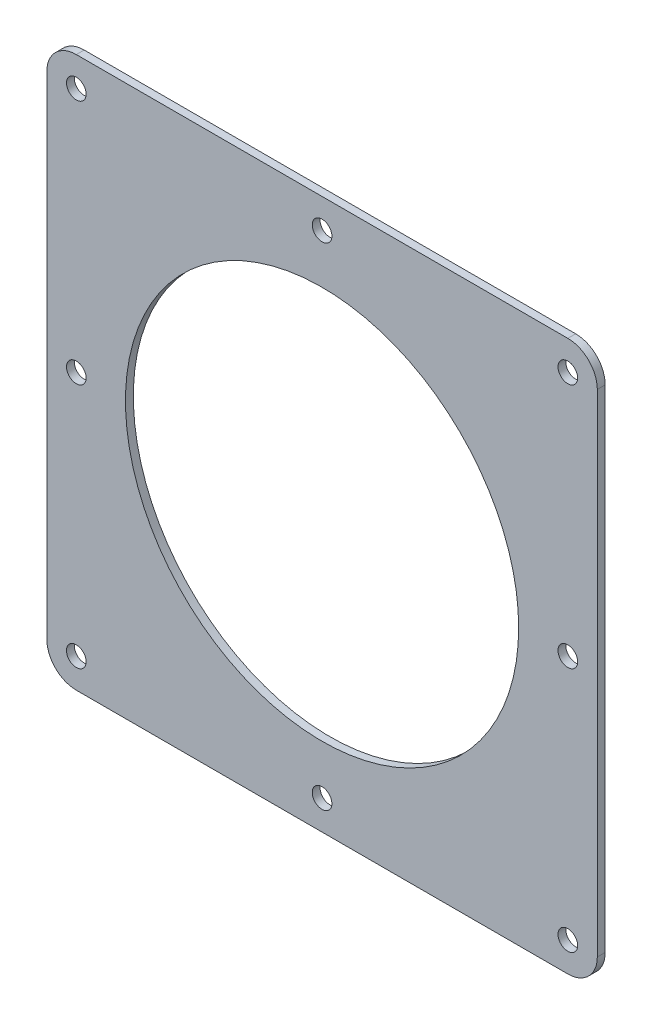
from build123d import *

# Parameters (mm, degrees)
SKETCH2_R           = 5
SKETCH2_R_2         = 4
BOSS_EXTRUDE1_DEPTH = 4
SKETCH7_R           = 100
CUT_EXTRUDE2_DEPTH  = 10


with BuildPart() as part:
    # Sketch2 → Boss-Extrude1 (new body)
    with BuildSketch(Plane.XY):
        with BuildLine():
            Line((-125, 140), (125, 140))
            ThreePointArc((125, 140), (135.606601718, 135.606601718), (140, 125))
            Line((140, 125), (140, -125))
            ThreePointArc((140, -125), (135.606601718, -135.606601718), (125, -140))
            Line((125, -140), (-125, -140))
            ThreePointArc((-125, -140), (-135.606601718, -135.606601718), (-140, -125))
            Line((-140, -125), (-140, 125))
            ThreePointArc((-140, 125), (-135.606601718, 135.606601718), (-125, 140))
        make_face()
        with Locations((-125, 125)):
            Circle(SKETCH2_R, mode=Mode.SUBTRACT)
        with Locations((0, 125)):
            Circle(SKETCH2_R, mode=Mode.SUBTRACT)
        with Locations((125, 125)):
            Circle(SKETCH2_R, mode=Mode.SUBTRACT)
        Circle(SKETCH2_R_2, mode=Mode.SUBTRACT)
        with Locations((125, 0)):
            Circle(SKETCH2_R, mode=Mode.SUBTRACT)
        with Locations((-125, 0)):
            Circle(SKETCH2_R, mode=Mode.SUBTRACT)
        with Locations((-125, -125)):
            Circle(SKETCH2_R, mode=Mode.SUBTRACT)
        with Locations((0, -125)):
            Circle(SKETCH2_R, mode=Mode.SUBTRACT)
        with Locations((125, -125)):
            Circle(SKETCH2_R, mode=Mode.SUBTRACT)
    extrude(amount=BOSS_EXTRUDE1_DEPTH)

    # Sketch7 → Cut-Extrude2 (cut)
    with BuildSketch(Plane.XY.offset(4)):
        Circle(SKETCH7_R)
    extrude(amount=-CUT_EXTRUDE2_DEPTH, mode=Mode.SUBTRACT)


solid = part.part
